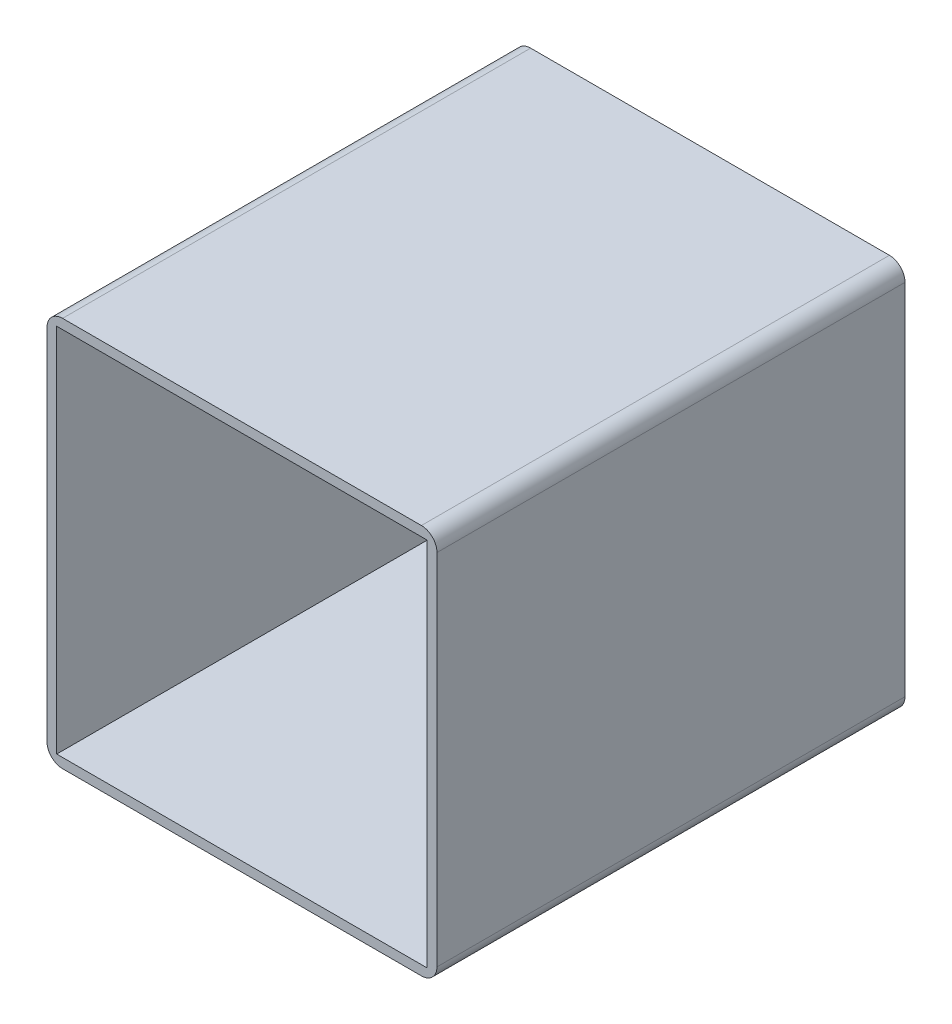
from build123d import *

# Parameters (mm, degrees)
SKETCH1_W           = 63.5
SKETCH1_H           = 63.5
BOSS_EXTRUDE1_DEPTH = 76.2
SKETCH2_W           = 60.325
SKETCH2_H           = 60.325
CUT_EXTRUDE1_DEPTH  = 75.4
FILLET1_R           = 2.54
SKETCH3_R           = 3.175
CUT_EXTRUDE2_DEPTH  = 89.44526556
SKETCH4_R           = 4.064
CUT_EXTRUDE3_DEPTH  = 89.44526556


with BuildPart() as part:
    # Sketch1 → Boss-Extrude1 (new body)
    with BuildSketch(Plane.XY):
        Rectangle(SKETCH1_W, SKETCH1_H)
    extrude(amount=BOSS_EXTRUDE1_DEPTH)

    # Sketch2 → Cut-Extrude1 (cut)
    with BuildSketch(Plane.XY.offset(76.2)):
        Rectangle(SKETCH2_W, SKETCH2_H)
    extrude(amount=-CUT_EXTRUDE1_DEPTH, mode=Mode.SUBTRACT)

    # Fillet1
    fillet1_edges = [part.edges().sort_by_distance(p)[0] for p in [
        (31.75, -31.75, 38.1),
        (-31.75, -31.75, 38.1),
        (-31.75, 31.75, 38.1),
        (31.75, 31.75, 38.1),
    ]]
    fillet(fillet1_edges, radius=FILLET1_R)

    # Sketch3 → Cut-Extrude2 (cut, through all)
    with BuildSketch(Plane(origin=(0, 0, 0), x_dir=(-1, 0, 0), z_dir=(0, 0, -1))):
        with Locations((0, 19.05)):
            Circle(SKETCH3_R)
        with Locations((0, -19.05)):
            Circle(SKETCH3_R)
        Circle(SKETCH3_R)
        with Locations((19.05, 0)):
            Circle(SKETCH3_R)
        with Locations((-19.05, 0)):
            Circle(SKETCH3_R)
    extrude(amount=-CUT_EXTRUDE2_DEPTH, mode=Mode.SUBTRACT)

    # Sketch4 → Cut-Extrude3 (cut, through all)
    with BuildSketch(Plane(origin=(0, 0, 0), x_dir=(-1, 0, 0), z_dir=(0, 0, -1))):
        with Locations((-15.875, -19.05)):
            Circle(SKETCH4_R)
        with Locations((15.875, -19.05)):
            Circle(SKETCH4_R)
    extrude(amount=-CUT_EXTRUDE3_DEPTH, mode=Mode.SUBTRACT)


solid = part.part
